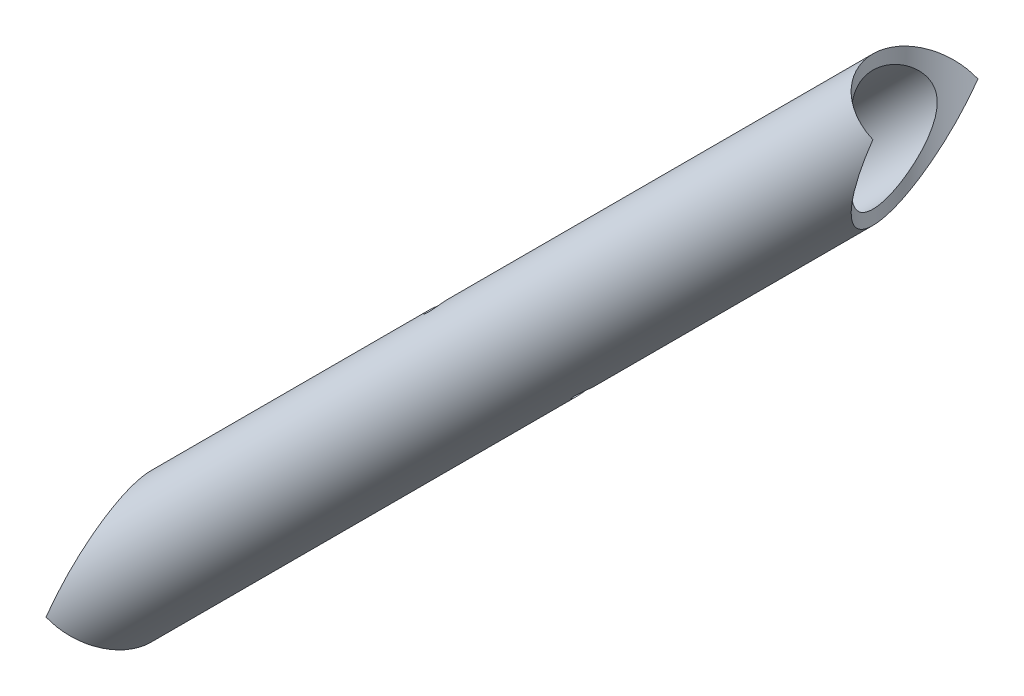
from build123d import *

# Parameters (mm, degrees)
CUT_EXTRUDE3_DEPTH      = 152.4
CUT_EXTRUDE3_DEPTH_BACK = 152.4
SKETCH7_W               = 36.378606507
SKETCH7_H               = 116.13134521
SKETCH7_W_2             = 19.354553336
SKETCH7_H_2             = 94.547767977
CUT_EXTRUDE4_DEPTH      = 152.4
CUT_EXTRUDE4_DEPTH_BACK = 152.4
SKETCH8_R               = 12.7
CUT_EXTRUDE5_DEPTH      = 152.4
CUT_EXTRUDE5_DEPTH_BACK = 152.4
SKETCH9_R               = 2.5


with BuildPart() as part:
    # Sketch4 → Revolve1 (revolve)
    with BuildSketch(Plane.XY):
        Polygon((-116.168451761, -101.620436845), (101.620436845, 116.168451761), (99.914188182, 117.874700424), (-117.874700424, -99.914188182), align=None)
    revolve(axis=Axis((-13.229718862, -13.229718862, 0), (0.7071067811865459, 0.7071067811865491, 0)))

    # Sketch7 → Cut-Extrude3 (cut, two sides: drawn at the far end of the back side and taken through both)
    with BuildSketch(Plane.XY.offset(-CUT_EXTRUDE3_DEPTH_BACK)):
        with Locations((118.103491436, 117.874700424)):
            Rectangle(SKETCH7_W, SKETCH7_H)
        with Locations((-109.59146485, -93.168602941)):
            Rectangle(SKETCH7_W_2, SKETCH7_H_2)
    extrude(amount=CUT_EXTRUDE3_DEPTH + CUT_EXTRUDE3_DEPTH_BACK, mode=Mode.SUBTRACT)

    # Sketch8 → Cut-Extrude4 (cut, two sides: drawn at the far end of the back side and taken through both)
    with BuildSketch(Plane(origin=(0, 0, 0), x_dir=(1, 0, 0), z_dir=(0, 1, 0)).offset(-CUT_EXTRUDE4_DEPTH_BACK)):
        with Locations((-99.914188182, 0)):
            Circle(SKETCH8_R)
        with Locations((99.914188182, 0)):
            Circle(SKETCH8_R)
    extrude(amount=CUT_EXTRUDE4_DEPTH + CUT_EXTRUDE4_DEPTH_BACK, mode=Mode.SUBTRACT)

    # Sketch9 → Cut-Extrude5 (cut, two sides: drawn at the far end of the back side and taken through both)
    with BuildSketch(Plane(origin=(0, 0, 0), x_dir=(0, 0, -1), z_dir=(1, 0, 0)).offset(-CUT_EXTRUDE5_DEPTH_BACK)):
        Circle(SKETCH9_R)
    extrude(amount=CUT_EXTRUDE5_DEPTH + CUT_EXTRUDE5_DEPTH_BACK, mode=Mode.SUBTRACT)


solid = part.part
